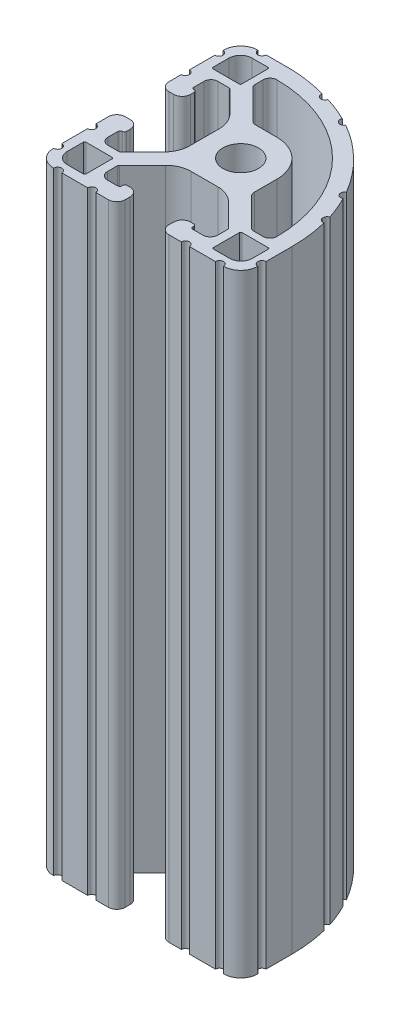
from build123d import *

# Parameters (mm, degrees)
SKETCH12_R                = 3.3274
F_15_1517_PROFILE_1_DEPTH = 114.3


with BuildPart() as part:
    # Sketch12 → 15 1517 PROFILE(1) (new body)
    with BuildSketch(Plane(origin=(0, -57.15, 0), x_dir=(-1, 0, 0), z_dir=(0, 1, 0))):
        with BuildLine():
            Line((-5.855816591, 8.147584211), (-10.175407684, 12.467175304))
            ThreePointArc((-10.175407684, 12.467175304), (-10.257998102, 12.590780599), (-10.287, 12.736582987))
            Line((-10.287, 12.736582987), (-10.287, 14.569878534))
            ThreePointArc((-10.287, 14.569878534), (-9.878755558, 15.555467801), (-8.89316629, 15.963712243))
            Line((-8.89316629, 15.963712243), (-6.999167103, 15.963712243))
            ThreePointArc((-6.999167103, 15.963712243), (-6.72975942, 15.852119927), (-6.618167103, 15.582712243))
            Line((-6.618167103, 15.582712243), (-6.618167103, 15.367))
            ThreePointArc((-6.618167103, 15.367), (-6.506574787, 15.097592316), (-6.237167103, 14.986))
            Line((-6.237167103, 14.986), (-5.6388, 14.986))
            ThreePointArc((-5.6388, 14.986), (-4.525248241, 15.447248241), (-4.064, 16.5608))
            Line((-4.064, 16.5608), (-4.064, 17.4752))
            ThreePointArc((-4.064, 17.4752), (-4.525248241, 18.588751759), (-5.6388, 19.05))
            Line((-5.6388, 19.05), (-7.975808612, 19.05))
            ThreePointArc((-7.975808612, 19.05), (-8.737808612, 18.288), (-9.499808612, 19.05))
            Line((-9.499808612, 19.05), (-14.328223272, 19.05))
            ThreePointArc((-14.328223272, 19.05), (-15.090223272, 18.288), (-15.852223272, 19.05))
            Line((-15.852223272, 19.05), (-15.875852034, 19.05))
            ThreePointArc((-15.875852034, 19.05), (-18.12054407, 18.120435963), (-19.05085186, 15.87605207))
            Line((-19.05085186, 15.87605207), (-19.050837856, 15.850579848))
            ThreePointArc((-19.050837856, 15.850579848), (-18.288384143, 15.088998911), (-19.05, 14.32658008))
            Line((-19.05, 14.32658008), (-19.05, 12.732288231))
            Line((-19.05, 12.732288231), (-19.05, 9.525048511))
            ThreePointArc((-19.05, 9.525048511), (-18.844960924, 6.073606423), (-18.224093909, 2.672280555))
            ThreePointArc((-18.224093909, 2.672280555), (-17.297425672, 2.136472625), (-17.820830396, 1.202742656))
            ThreePointArc((-17.820830396, 1.202742656), (-17.023706771, -0.946565585), (-16.056863602, -3.025061742))
            ThreePointArc((-16.056863602, -3.025061742), (-15.035371139, -3.344995028), (-15.341656086, -4.370662465))
            ThreePointArc((-15.341656086, -4.370662465), (-13.165262011, -7.582681452), (-10.573808085, -10.470262392))
            ThreePointArc((-10.573808085, -10.470262392), (-7.668241397, -13.006038729), (-4.447687438, -15.127479658))
            ThreePointArc((-4.447687438, -15.127479658), (-3.422020001, -14.821194711), (-3.102086715, -15.842687174))
            ThreePointArc((-3.102086715, -15.842687174), (-0.919134849, -16.817197941), (1.337634319, -17.605831579))
            ThreePointArc((1.337634319, -17.605831579), (2.271364288, -17.082426855), (2.807172217, -18.009095093))
            ThreePointArc((2.807172217, -18.009095093), (6.128127796, -18.72920779), (9.511085172, -19.05))
            Line((9.511085172, -19.05), (12.718324892, -19.05))
            Line((12.718324892, -19.05), (14.313588533, -19.05))
            ThreePointArc((14.313588533, -19.05), (15.075956274, -18.288384117), (15.837588355, -19.050735675))
            ThreePointArc((15.837588355, -19.050735675), (18.15779509, -18.085838645), (19.05, -15.736720519))
            ThreePointArc((19.05, -15.736720519), (18.288, -14.974720519), (19.05, -14.212720519))
            Line((19.05, -14.212720519), (19.05, -9.494484795))
            ThreePointArc((19.05, -9.494484795), (18.288, -8.732484795), (19.05, -7.970484795))
            Line((19.05, -7.970484795), (19.05, -5.6388))
            ThreePointArc((19.05, -5.6388), (18.588751759, -4.525248241), (17.4752, -4.064))
            Line((17.4752, -4.064), (16.5608, -4.064))
            ThreePointArc((16.5608, -4.064), (15.447248241, -4.525248241), (14.986, -5.6388))
            Line((14.986, -5.6388), (14.986, -6.323339378))
            ThreePointArc((14.986, -6.323339378), (15.097592316, -6.592747061), (15.367, -6.704339378))
            Line((15.367, -6.704339378), (15.458830022, -6.704339378))
            ThreePointArc((15.458830022, -6.704339378), (15.728237706, -6.815931694), (15.839830022, -7.085339378))
            Line((15.839830022, -7.085339378), (15.839830022, -9.017))
            ThreePointArc((15.839830022, -9.017), (15.467855635, -9.915025612), (14.569830022, -10.287))
            Line((14.569830022, -10.287), (12.463570685, -10.287))
            ThreePointArc((12.463570685, -10.287), (12.317768298, -10.257998102), (12.194163002, -10.175407684))
            Line((12.194163002, -10.175407684), (8.148592848, -6.12983753))
            ThreePointArc((8.148592848, -6.12983753), (7.118219133, -4.58777429), (6.7564, -2.768786675))
            Line((6.7564, -2.768786675), (6.7564, 2.768786675))
            ThreePointArc((6.7564, 2.768786675), (7.118219133, 4.58777429), (8.148592848, 6.12983753))
            Line((8.148592848, 6.12983753), (12.194163002, 10.175407684))
            ThreePointArc((12.194163002, 10.175407684), (12.317768298, 10.257998102), (12.463570685, 10.287))
            Line((12.463570685, 10.287), (14.503581688, 10.287))
            ThreePointArc((14.503581688, 10.287), (15.4016073, 9.915025612), (15.773581688, 9.017))
            Line((15.773581688, 9.017), (15.773581688, 7.085339378))
            ThreePointArc((15.773581688, 7.085339378), (15.661989372, 6.815931694), (15.392581688, 6.704339378))
            Line((15.392581688, 6.704339378), (15.367, 6.704339378))
            ThreePointArc((15.367, 6.704339378), (15.097592316, 6.592747061), (14.986, 6.323339378))
            Line((14.986, 6.323339378), (14.986, 5.6388))
            ThreePointArc((14.986, 5.6388), (15.447248241, 4.525248241), (16.5608, 4.064))
            Line((16.5608, 4.064), (17.4752, 4.064))
            ThreePointArc((17.4752, 4.064), (18.588751759, 4.525248241), (19.05, 5.6388))
            Line((19.05, 5.6388), (19.05, 7.975937164))
            ThreePointArc((19.05, 7.975937164), (18.288, 8.737937164), (19.05, 9.499937164))
            Line((19.05, 9.499937164), (19.05, 14.328351583))
            ThreePointArc((19.05, 14.328351583), (18.288, 15.090351583), (19.05, 15.852351583))
            Line((19.05, 15.852351583), (19.05, 15.875001064))
            ThreePointArc((19.05, 15.875001064), (18.120064074, 18.120063986), (15.875001189, 19.05))
            Line((15.875001189, 19.05), (15.847027528, 19.05))
            ThreePointArc((15.847027528, 19.05), (15.085027528, 18.288), (14.323027528, 19.05))
            Line((14.323027528, 19.05), (9.494612868, 19.05))
            ThreePointArc((9.494612868, 19.05), (8.732612868, 18.288), (7.970612868, 19.05))
            Line((7.970612868, 19.05), (5.6388, 19.05))
            ThreePointArc((5.6388, 19.05), (4.525248241, 18.588751759), (4.064, 17.4752))
            Line((4.064, 17.4752), (4.064, 16.5608))
            ThreePointArc((4.064, 16.5608), (4.525248241, 15.447248241), (5.6388, 14.986))
            Line((5.6388, 14.986), (6.237167103, 14.986))
            ThreePointArc((6.237167103, 14.986), (6.506574787, 15.097592316), (6.618167103, 15.367))
            Line((6.618167103, 15.367), (6.618167103, 15.582712243))
            ThreePointArc((6.618167103, 15.582712243), (6.72975942, 15.852119927), (6.999167103, 15.963712243))
            Line((6.999167103, 15.963712243), (8.89316629, 15.963712243))
            ThreePointArc((8.89316629, 15.963712243), (9.878755558, 15.555467801), (10.287, 14.569878534))
            Line((10.287, 14.569878534), (10.287, 12.736582987))
            ThreePointArc((10.287, 12.736582987), (10.257998102, 12.590780599), (10.175407684, 12.467175304))
            Line((10.175407684, 12.467175304), (5.855816591, 8.147584211))
            ThreePointArc((5.855816591, 8.147584211), (4.314870569, 7.117956996), (2.497200801, 6.7564))
            Line((2.497200801, 6.7564), (-2.497200801, 6.7564))
            ThreePointArc((-2.497200801, 6.7564), (-4.314870569, 7.117956996), (-5.855816591, 8.147584211))
        make_face()
        Circle(SKETCH12_R, mode=Mode.SUBTRACT)
        with BuildLine():
            Line((11.8872, 16.9672), (11.8872, 12.094133798))
            ThreePointArc((11.8872, 12.094133798), (11.961594878, 11.914528676), (12.1412, 11.840133798))
            Line((12.1412, 11.840133798), (17.018, 11.840133798))
            ThreePointArc((17.018, 11.840133798), (17.197605122, 11.914528676), (17.272, 12.094133798))
            Line((17.272, 12.094133798), (17.272, 15.0876))
            ThreePointArc((17.272, 15.0876), (16.647083028, 16.596283028), (15.1384, 17.2212))
            Line((15.1384, 17.2212), (12.1412, 17.2212))
            ThreePointArc((12.1412, 17.2212), (11.961594878, 17.146805122), (11.8872, 16.9672))
        make_face(mode=Mode.SUBTRACT)
        with BuildLine():
            Line((11.892254607, -12.094133798), (11.892254607, -16.9672))
            ThreePointArc((11.892254607, -16.9672), (11.966649484, -17.146805122), (12.146254607, -17.2212))
            Line((12.146254607, -17.2212), (15.1384, -17.2212))
            ThreePointArc((15.1384, -17.2212), (16.647083028, -16.596283028), (17.272, -15.0876))
            Line((17.272, -15.0876), (17.272, -12.094133798))
            ThreePointArc((17.272, -12.094133798), (17.197605122, -11.914528676), (17.018, -11.840133798))
            Line((17.018, -11.840133798), (12.146254607, -11.840133798))
            ThreePointArc((12.146254607, -11.840133798), (11.966649484, -11.914528676), (11.892254607, -12.094133798))
        make_face(mode=Mode.SUBTRACT)
        with BuildLine():
            Line((10.571349784, -14.767607354), (10.571349784, -13.231353261))
            ThreePointArc((10.571349784, -13.231353261), (10.503678689, -12.89114769), (10.310967713, -12.602735333))
            Line((10.310967713, -12.602735333), (4.836606768, -7.128374388))
            ThreePointArc((4.836606768, -7.128374388), (4.424589115, -6.853072994), (3.938581156, -6.7564))
            Line((3.938581156, -6.7564), (0, -6.7564))
            ThreePointArc((0, -6.7564), (-4.777496256, -4.777496256), (-6.7564, 0))
            Line((-6.7564, 0), (-6.7564, 4.211593458))
            ThreePointArc((-6.7564, 4.211593458), (-6.853072994, 4.697601417), (-7.128374388, 5.10961907))
            Line((-7.128374388, 5.10961907), (-12.326279328, 10.307524009))
            ThreePointArc((-12.326279328, 10.307524009), (-12.614691685, 10.500234985), (-12.954897256, 10.567906081))
            Line((-12.954897256, 10.567906081), (-14.764163651, 10.567906081))
            ThreePointArc((-14.764163651, 10.567906081), (-15.665716473, 10.192390575), (-16.034124311, 9.287910033))
            ThreePointArc((-16.034124311, 9.287910033), (-8.566079095, -8.553631535), (9.268959288, -16.037194238))
            ThreePointArc((9.268959288, -16.037194238), (10.187849663, -15.677012635), (10.571349784, -14.767607354))
        make_face(mode=Mode.SUBTRACT)
        with BuildLine():
            Line((-17.272, 15.0876), (-17.272, 12.1411746))
            ThreePointArc((-17.272, 12.1411746), (-17.197605122, 11.961569478), (-17.018, 11.8871746))
            Line((-17.018, 11.8871746), (-12.1412, 11.8871746))
            ThreePointArc((-12.1412, 11.8871746), (-11.961594878, 11.961569478), (-11.8872, 12.1411746))
            Line((-11.8872, 12.1411746), (-11.8872, 16.9672))
            ThreePointArc((-11.8872, 16.9672), (-11.961594878, 17.146805122), (-12.1412, 17.2212))
            Line((-12.1412, 17.2212), (-15.1384, 17.2212))
            ThreePointArc((-15.1384, 17.2212), (-16.647083028, 16.596283028), (-17.272, 15.0876))
        make_face(mode=Mode.SUBTRACT)
    extrude(amount=F_15_1517_PROFILE_1_DEPTH)


solid = part.part
